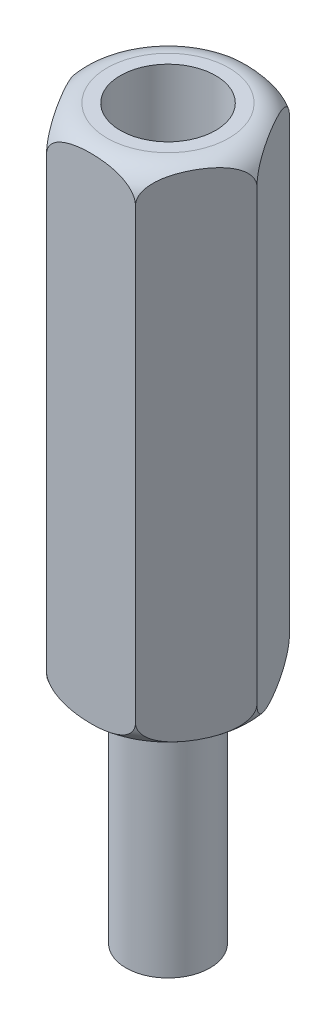
from build123d import *

# Parameters (mm, degrees)
BOSS_EXTRUDE1_DEPTH      = 18
M3_CLEARANCE_HOLE1_D     = 3.4
M3_CLEARANCE_HOLE1_DEPTH = 12
M3_CLEARANCE_HOLE1_TIP   = 1.021463052
SKETCH5_R                = 1.5
BOSS_EXTRUDE2_DEPTH      = 8


with BuildPart() as part:
    # Sketch1 → Boss-Extrude1 (new body)
    with BuildSketch(Plane(origin=(0, 0, 0), x_dir=(1, 0, 0), z_dir=(0, 1, 0))):
        Polygon((3.175426481, 0), (1.58771324, 2.75), (-1.58771324, 2.75), (-3.175426481, 0), (-1.58771324, -2.75), (1.58771324, -2.75), align=None)
    extrude(amount=BOSS_EXTRUDE1_DEPTH)

    # M3 Clearance Hole1
    with Locations(Plane(origin=(0, 18, 0), x_dir=(-1, 0, 0), z_dir=(0, 1, 0))):
        with Locations((0, 0)):
            Hole(M3_CLEARANCE_HOLE1_D / 2, depth=M3_CLEARANCE_HOLE1_DEPTH)
            with Locations((0, 0, -(M3_CLEARANCE_HOLE1_DEPTH + M3_CLEARANCE_HOLE1_TIP / 2))):  # 118° drill point
                Cone(0, M3_CLEARANCE_HOLE1_D / 2, M3_CLEARANCE_HOLE1_TIP, mode=Mode.SUBTRACT)

    # Sketch4 → Cut-Revolve1 (revolve, cut)
    with BuildSketch(Plane.XY, mode=Mode.PRIVATE) as cut_revolve1_sk:
        with BuildLine():
            Line((-2.175426481, 18), (-3.175426481, 18))
            Line((-3.175426481, 18), (-3.175426481, 17))
            ThreePointArc((-3.175426481, 17), (-2.882533262, 17.707106781), (-2.175426481, 18))
        make_face()
        with BuildLine():
            Line((-3.175426481, 1), (-3.175426481, 0))
            Line((-3.175426481, 0), (-2.175426481, 0))
            ThreePointArc((-2.175426481, 0), (-2.882533262, 0.292893219), (-3.175426481, 1))
        make_face()
    revolve(cut_revolve1_sk.sketch.rotate(Axis((0, 18, 0), (0, -1, 0)), 270), axis=Axis((0, 18, 0), (0, -1, 0)), mode=Mode.SUBTRACT)

    # Sketch5 → Boss-Extrude2 (add)
    with BuildSketch(Plane.XZ):
        with Locations(Location((0, 0, 0), (0, 0, 90))):
            Circle(SKETCH5_R)
    extrude(amount=BOSS_EXTRUDE2_DEPTH)


solid = part.part
